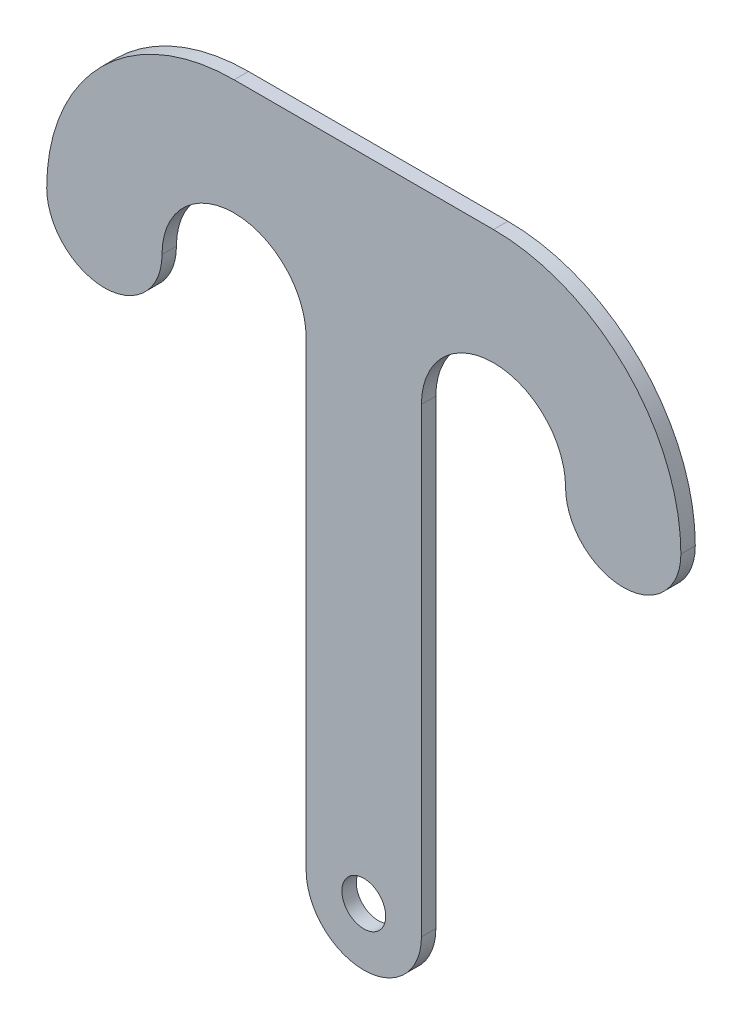
from build123d import *

# Parameters (mm, degrees)
SKETCH1_R           = 4.826
BOSS_EXTRUDE2_DEPTH = 3.175


with BuildPart() as part:
    # Sketch1 → Boss-Extrude2 (new body)
    with BuildSketch(Plane.XY):
        with BuildLine():
            Line((12.7, 0), (12.7, 101.6))
            ThreePointArc((12.7, 101.6), (28.575, 117.475), (44.45, 101.6))
            ThreePointArc((44.45, 101.6), (57.15, 88.9), (69.85, 101.6))
            ThreePointArc((69.85, 101.6), (57.760832393, 130.785832393), (28.575, 142.875))
            Line((28.575, 142.875), (-28.575, 142.875))
            ThreePointArc((-28.575, 142.875), (-57.760832393, 130.785832393), (-69.85, 101.6))
            ThreePointArc((-69.85, 101.6), (-57.15, 88.9), (-44.45, 101.6))
            ThreePointArc((-44.45, 101.6), (-28.575, 117.475), (-12.7, 101.6))
            Line((-12.7, 101.6), (-12.7, 0))
            ThreePointArc((-12.7, 0), (0, -12.7), (12.7, 0))
        make_face()
        Circle(SKETCH1_R, mode=Mode.SUBTRACT)
    extrude(amount=BOSS_EXTRUDE2_DEPTH)


solid = part.part
